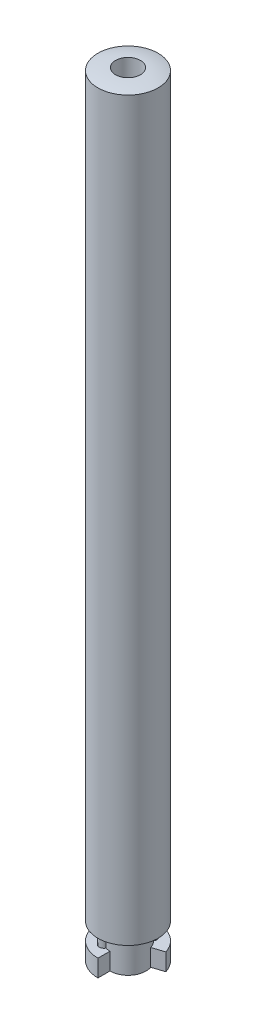
from build123d import *

# Parameters (mm, degrees)
SKETCH_1_R          = 3.5
EXTRUDE_1_DEPTH     = 90
CUT_EXTRUDE_1_DEPTH = 2
SKETCH_3_R          = 3.5
SKETCH_3_R_2        = 2.1
CUT_EXTRUDE_3_DEPTH = 2
SKETCH_4_R          = 0.548210007
EXTRUDE_2_DEPTH     = 2
SKETCH_5_R          = 1.45
CUT_EXTRUDE_5_DEPTH = 10


with BuildPart() as part:
    # 草图1 → 凸台-拉伸1 (new body)
    with BuildSketch(Plane(origin=(0, 0, 0), x_dir=(1, 0, 0), z_dir=(0, 1, 0))):
        with Locations(Location((0, 0, 0), (0, 0, 90))):
            Circle(SKETCH_1_R)
    extrude(amount=EXTRUDE_1_DEPTH)

    # 草图2 → 切除-拉伸1 (cut)
    with BuildSketch(Plane.XZ):
        with BuildLine():
            Line((0, 3.5), (0, 2.1))
            ThreePointArc((0, 2.1), (1.698935688, 1.23434903), (1.997218684, -0.648935688))
            Line((1.997218684, -0.648935688), (3.328697807, -1.08155948))
            ThreePointArc((3.328697807, -1.08155948), (3.456909192, -0.547520628), (3.5, 0))
            ThreePointArc((3.5, 0), (2.474873734, 2.474873734), (0, 3.5))
        make_face()
        with BuildLine():
            ThreePointArc((0, -2.1), (-1.698935688, -1.23434903), (-1.997218684, 0.648935688))
            Line((-1.997218684, 0.648935688), (-3.328697807, 1.08155948))
            ThreePointArc((-3.328697807, 1.08155948), (-2.83155948, -2.057248383), (0, -3.5))
            Line((0, -3.5), (0, -2.1))
        make_face()
    extrude(amount=-CUT_EXTRUDE_1_DEPTH, mode=Mode.SUBTRACT)

    # 草图3 → 切除-拉伸3 (cut)
    with BuildSketch(Plane.XZ.offset(-2)):
        with Locations(Location((0, 0, 0), (0, 0, 270))):
            Circle(SKETCH_3_R)
        with Locations(Location((0, 0, 0), (0, 0, 270))):
            Circle(SKETCH_3_R_2, mode=Mode.SUBTRACT)
    extrude(amount=-CUT_EXTRUDE_3_DEPTH, mode=Mode.SUBTRACT)

    # 草图4 → 凸台-拉伸2 (add)
    with BuildSketch(Plane(origin=(0, 2, 0), x_dir=(1, 0, 0), z_dir=(0, 1, 0))):
        with Locations((-1.025992333, -1.768146991)):
            Circle(SKETCH_4_R)
        with Locations((1.025992333, 1.768146991)):
            Circle(SKETCH_4_R)
    extrude(amount=EXTRUDE_2_DEPTH)

    # 草图5 → 切除-拉伸5 (cut)
    with BuildSketch(Plane(origin=(0, 90, 0), x_dir=(1, 0, 0), z_dir=(0, 1, 0))):
        with Locations(Location((0, 0, 0), (0, 0, 270))):
            Circle(SKETCH_5_R)
    extrude(amount=-CUT_EXTRUDE_5_DEPTH, mode=Mode.SUBTRACT)

    # 草图6 → 切除-旋转2 (revolve, cut)
    with BuildSketch(Plane.XY, mode=Mode.PRIVATE) as cut_revolve_2_sk:
        with BuildLine():
            Line((3.5, 90), (3.5, 89.7))
            add(Edge.make_bspline(
                [(3.5, 89.7), (2.810594715, 89.888843462), (2.108922974, 89.988601578), (1.395404454, 90)],
                knots=[0, 0, 0, 0, 0.917895011, 0.917895011, 0.917895011, 0.917895011], degree=3))
            Line((1.395404454, 90), (3.5, 90))
        make_face()
    revolve(cut_revolve_2_sk.sketch.rotate(Axis((0, 107.628853611, 0), (0, -1, 0)), 270), axis=Axis((0, 107.628853611, 0), (0, -1, 0)), mode=Mode.SUBTRACT)


solid = part.part
